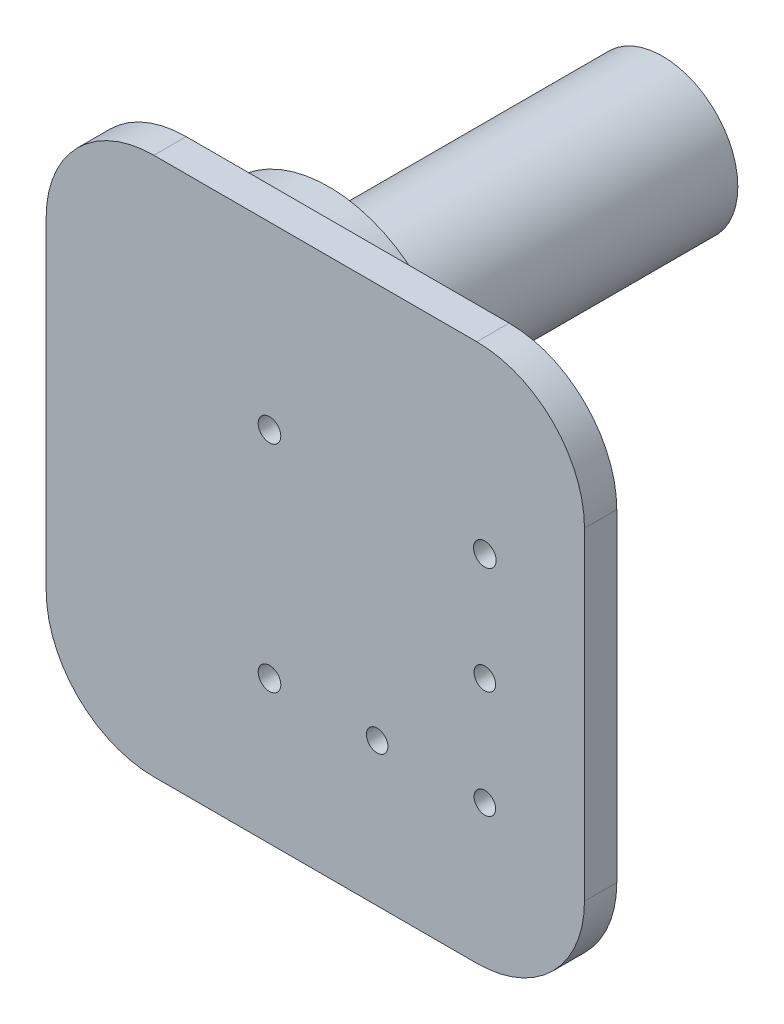
from build123d import *

# Parameters (mm, degrees)
SKETCH_1_R           = 7
EXTRUDE_1_DEPTH      = 34
EXTRUDE_2_DEPTH      = 2
EXTRUDE_2_DEPTH_BACK = 3
SKETCH_2_R           = 12
SKETCH_3_W           = 50
SKETCH_3_H           = 50
EXTRUDE_4_DEPTH      = 3
SKETCH_5_R           = 1.05
SKETCH_5_R_2         = 1
CUT_EXTRUDE_1_DEPTH  = 5
FILLET_1_R           = 10


with BuildPart() as part:
    # 草图1 → 凸台-拉伸1 (new body)
    with BuildSketch(Plane.XY):
        with Locations((-86.606649797, -63.783530386)):
            Circle(SKETCH_1_R)
    extrude(amount=EXTRUDE_1_DEPTH)

    # 草图2 → 凸台-拉伸2 (add, two sides: drawn at the far end of the back side and taken through both)
    with BuildSketch(Plane.XY.offset(34).offset(-EXTRUDE_2_DEPTH_BACK)):
        with Locations((-86.606649797, -63.783530386)):
            Circle(SKETCH_2_R)
    extrude(amount=EXTRUDE_2_DEPTH + EXTRUDE_2_DEPTH_BACK)

    # 草图3 → 凸台-拉伸4 (add)
    with BuildSketch(Plane.XY.offset(36)):
        with Locations((-79.849508923, -74.381256309)):
            Rectangle(SKETCH_3_W, SKETCH_3_H)
    extrude(amount=EXTRUDE_4_DEPTH)

    # 草图5 → 切除-拉伸1 (cut)
    with BuildSketch(Plane.XY.offset(39)):
        with Locations((-84.106649797, -86.087855448)):
            Circle(SKETCH_5_R)
        with Locations((-74.106649797, -86.087855448)):
            Circle(SKETCH_5_R_2)
        with Locations((-64.106649797, -86.087855448)):
            Circle(SKETCH_5_R_2)
        with Locations((-64.106649797, -76.087855448)):
            Circle(SKETCH_5_R_2)
        with Locations((-64.106649797, -66.087855448)):
            Circle(SKETCH_5_R)
        with Locations((-84.106649797, -66.087855448)):
            Circle(SKETCH_5_R)
    extrude(amount=-CUT_EXTRUDE_1_DEPTH, mode=Mode.SUBTRACT)

    # 圆角1
    fillet_1_edges = [part.edges().sort_by_distance(p)[0] for p in [
        (-104.849508923, -49.381256309, 37.5),
        (-104.849508923, -99.381256309, 37.5),
        (-54.849508923, -99.381256309, 37.5),
        (-54.849508923, -49.381256309, 37.5),
    ]]
    fillet(fillet_1_edges, radius=FILLET_1_R)


solid = part.part
